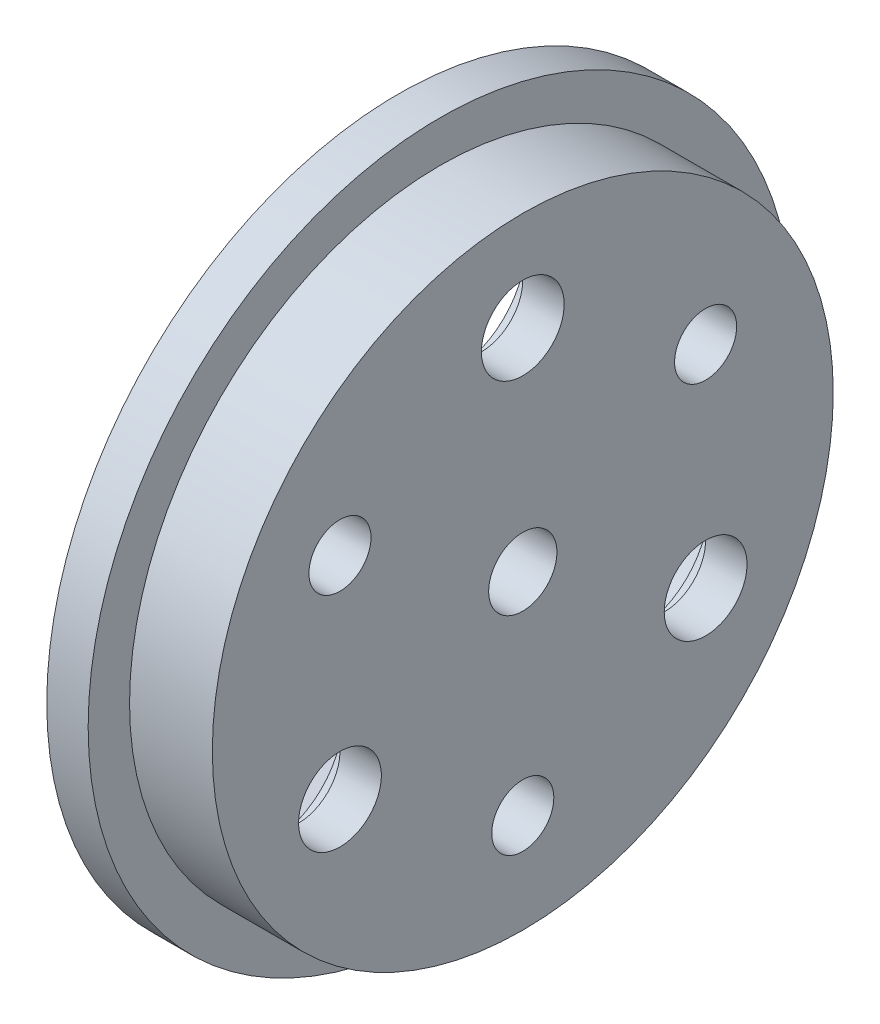
from build123d import *

# Parameters (mm, degrees)
SKETCH_4_R          = 17
EXTRUDE_2_DEPTH     = 2
SKETCH_5_R          = 15
EXTRUDE_3_DEPTH     = 4
CUT_EXTRUDE_1_DEPTH = 2.6
SKETCH_7_R          = 3.55
CUT_EXTRUDE_2_DEPTH = 1.4
SKETCH_8_R          = 2
CUT_EXTRUDE_3_DEPTH = 25.280856657
SKETCH_9_R          = 5.5
CUT_EXTRUDE_4_DEPTH = 1
SKETCH_11_R         = 1.65
CUT_EXTRUDE_5_DEPTH = 25.309668858
SKETCH_13_R         = 1.5
CUT_EXTRUDE_6_DEPTH = 25.779023387


with BuildPart() as part:
    # 草图4 → 凸台-拉伸2 (new body)
    with BuildSketch(Plane(origin=(0, 0, 0), x_dir=(0, 0, -1), z_dir=(1, 0, 0))):
        Circle(SKETCH_4_R)
    extrude(amount=EXTRUDE_2_DEPTH)

    # 草图5 → 凸台-拉伸3 (add)
    with BuildSketch(Plane(origin=(2, 0, 0), x_dir=(0, 0, -1), z_dir=(1, 0, 0))):
        Circle(SKETCH_5_R)
    extrude(amount=EXTRUDE_3_DEPTH)

    # 草图6 → 切除-拉伸1 (cut)
    with BuildSketch(Plane.ZY):
        with BuildLine():
            Line((-3.031088913, 12.75), (-12.557368355, -3.75))
            ThreePointArc((-12.557368355, -3.75), (-12.557368355, -7.25), (-9.526279442, -9))
            Line((-9.526279442, -9), (9.526279442, -9))
            ThreePointArc((9.526279442, -9), (12.557368355, -7.25), (12.557368355, -3.75))
            Line((12.557368355, -3.75), (3.031088913, 12.75))
            ThreePointArc((3.031088913, 12.75), (0, 14.5), (-3.031088913, 12.75))
        make_face()
    extrude(amount=-CUT_EXTRUDE_1_DEPTH, mode=Mode.SUBTRACT)

    # 草图7 → 切除-拉伸2 (cut)
    with BuildSketch(Plane.ZY.offset(-2.6)):
        with Locations((0, 10.2)):
            Circle(SKETCH_7_R)
        with Locations((8.833459119, -5.1)):
            Circle(SKETCH_7_R)
        with Locations((-8.833459119, -5.1)):
            Circle(SKETCH_7_R)
    extrude(amount=-CUT_EXTRUDE_2_DEPTH, mode=Mode.SUBTRACT)

    # 草图8 → 切除-拉伸3 (cut, through all)
    with BuildSketch(Plane.ZY.offset(-2.6)):
        with Locations((0, 10.2)):
            Circle(SKETCH_8_R)
        with Locations((8.833459119, -5.1)):
            Circle(SKETCH_8_R)
        with Locations((-8.833459119, -5.1)):
            Circle(SKETCH_8_R)
    extrude(amount=-CUT_EXTRUDE_3_DEPTH, mode=Mode.SUBTRACT)

    # 草图9 → 切除-拉伸4 (cut)
    with BuildSketch(Plane.ZY.offset(-2.6)):
        Circle(SKETCH_9_R)
    extrude(amount=-CUT_EXTRUDE_4_DEPTH, mode=Mode.SUBTRACT)

    # 草图11 → 切除-拉伸5 (cut, through all)
    with BuildSketch(Plane.ZY.offset(-3.6)):
        Circle(SKETCH_11_R)
    extrude(amount=-CUT_EXTRUDE_5_DEPTH, mode=Mode.SUBTRACT)

    # 草图13 → 切除-拉伸6 (cut, through all)
    with BuildSketch(Plane(origin=(6, 0, 0), x_dir=(0, 0, -1), z_dir=(1, 0, 0))):
        with Locations((-8.833459119, 5.1)):
            Circle(SKETCH_13_R)
        with Locations((8.833459119, 5.1)):
            Circle(SKETCH_13_R)
        with Locations((0, -10.2)):
            Circle(SKETCH_13_R)
    extrude(amount=-CUT_EXTRUDE_6_DEPTH, mode=Mode.SUBTRACT)


solid = part.part
